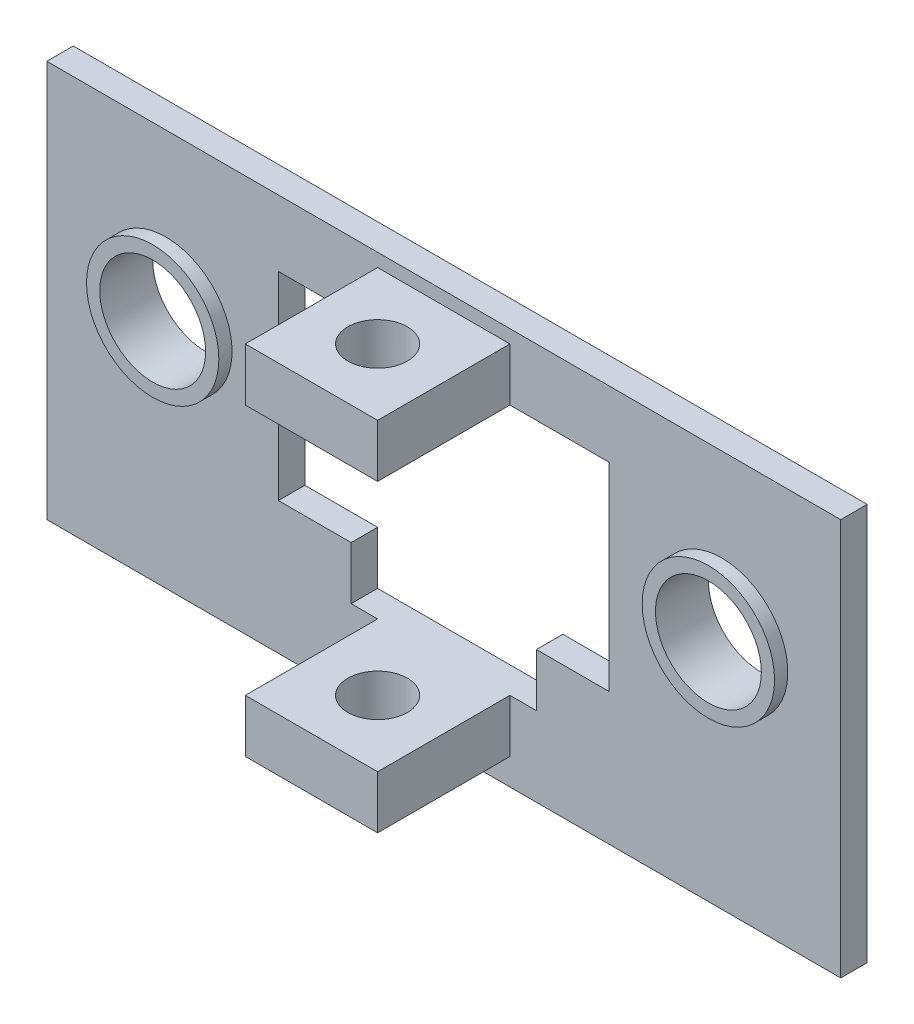
from build123d import *

# Parameters (mm, degrees)
SKETCH1_W           = 60
SKETCH1_H           = 30
BOSS_EXTRUDE1_DEPTH = 2
SKETCH2_R           = 4
CUT_EXTRUDE1_DEPTH  = 13
SKETCH3_W           = 25
SKETCH3_H           = 15
CUT_EXTRUDE2_DEPTH  = 34.600595233
BOSS_EXTRUDE2_START = 1
SKETCH5_R           = 5
SKETCH5_R_2         = 4
BOSS_EXTRUDE2_DEPTH = 1
SKETCH7_R           = 5
SKETCH7_R_2         = 4
BOSS_EXTRUDE3_DEPTH = 1
SKETCH9_W           = 10
SKETCH9_H           = 4
BOSS_EXTRUDE4_DEPTH = 10
SKETCH10_R          = 2.25
CUT_EXTRUDE3_DEPTH  = 41.853396432
SKETCH11_R          = 2.25
CUT_EXTRUDE4_DEPTH  = 43.755116653
SKETCH13_W          = 14
SKETCH13_H          = 4
CUT_EXTRUDE6_DEPTH  = 36


with BuildPart() as part:
    # Sketch1 → Boss-Extrude1 (new body)
    with BuildSketch(Plane.XY):
        Rectangle(SKETCH1_W, SKETCH1_H)
    extrude(amount=BOSS_EXTRUDE1_DEPTH)

    # Sketch2 → Cut-Extrude1 (cut)
    with BuildSketch(Plane.XY.offset(2)):
        with Locations((-21, 3)):
            Circle(SKETCH2_R)
        with Locations((21, 3)):
            Circle(SKETCH2_R)
    extrude(amount=-CUT_EXTRUDE1_DEPTH, mode=Mode.SUBTRACT)

    # Sketch3 → Cut-Extrude2 (cut, through all)
    with BuildSketch(Plane.XY.offset(2)):
        with Locations((0, 2.5)):
            Rectangle(SKETCH3_W, SKETCH3_H)
    extrude(amount=-CUT_EXTRUDE2_DEPTH, mode=Mode.SUBTRACT)

    # Sketch5 → Boss-Extrude2 (add)
    # profile 1 of 2: a face of its own
    with BuildSketch(Plane.XY.offset(2).offset(BOSS_EXTRUDE2_START)):
        with Locations(Location((-21, 3, 0), (0, 0, 180))):
            Circle(SKETCH5_R)
        with Locations((-21, 3)):
            Circle(SKETCH5_R_2, mode=Mode.SUBTRACT)
    # profile 2 of 2: a face of its own
    with BuildSketch(Plane.XY.offset(2).offset(BOSS_EXTRUDE2_START)):
        with Locations(Location((21, 3, 0), (0, 0, 180))):
            Circle(SKETCH5_R)
        with Locations((21, 3)):
            Circle(SKETCH5_R_2, mode=Mode.SUBTRACT)
    extrude(amount=-BOSS_EXTRUDE2_DEPTH)

    # Sketch7 → Boss-Extrude3 (add)
    # profile 1 of 2: a face of its own
    with BuildSketch(Plane(origin=(0, 0, 0), x_dir=(-1, 0, 0), z_dir=(0, 0, -1))):
        with Locations((-21, 3)):
            Circle(SKETCH7_R)
        with Locations(Location((-21, 3, 0), (0, 0, 180))):
            Circle(SKETCH7_R_2, mode=Mode.SUBTRACT)
    # profile 2 of 2: a face of its own
    with BuildSketch(Plane(origin=(0, 0, 0), x_dir=(-1, 0, 0), z_dir=(0, 0, -1))):
        with Locations((21, 3)):
            Circle(SKETCH7_R)
        with Locations(Location((21, 3, 0), (0, 0, 180))):
            Circle(SKETCH7_R_2, mode=Mode.SUBTRACT)
    extrude(amount=BOSS_EXTRUDE3_DEPTH)

    # Sketch9 → Boss-Extrude4 (add)
    with BuildSketch(Plane.XY.offset(2)):
        with Locations((0, -11)):
            Rectangle(SKETCH9_W, SKETCH9_H)
        with Locations((0, 12)):
            Rectangle(SKETCH9_W, SKETCH9_H)
    extrude(amount=BOSS_EXTRUDE4_DEPTH)

    # Sketch10 → Cut-Extrude3 (cut, through all)
    with BuildSketch(Plane.XZ.offset(-10)):
        with Locations((0, 7)):
            Circle(SKETCH10_R)
    extrude(amount=-CUT_EXTRUDE3_DEPTH, mode=Mode.SUBTRACT)

    # Sketch11 → Cut-Extrude4 (cut, through all)
    with BuildSketch(Plane.XZ.offset(13)):
        with Locations((0, 7)):
            Circle(SKETCH11_R)
    extrude(amount=-CUT_EXTRUDE4_DEPTH, mode=Mode.SUBTRACT)

    # Sketch13 → Cut-Extrude6 (cut, through all)
    with BuildSketch(Plane.XY.offset(2)):
        with Locations((0, -7)):
            Rectangle(SKETCH13_W, SKETCH13_H)
    extrude(amount=-CUT_EXTRUDE6_DEPTH, mode=Mode.SUBTRACT)


solid = part.part
